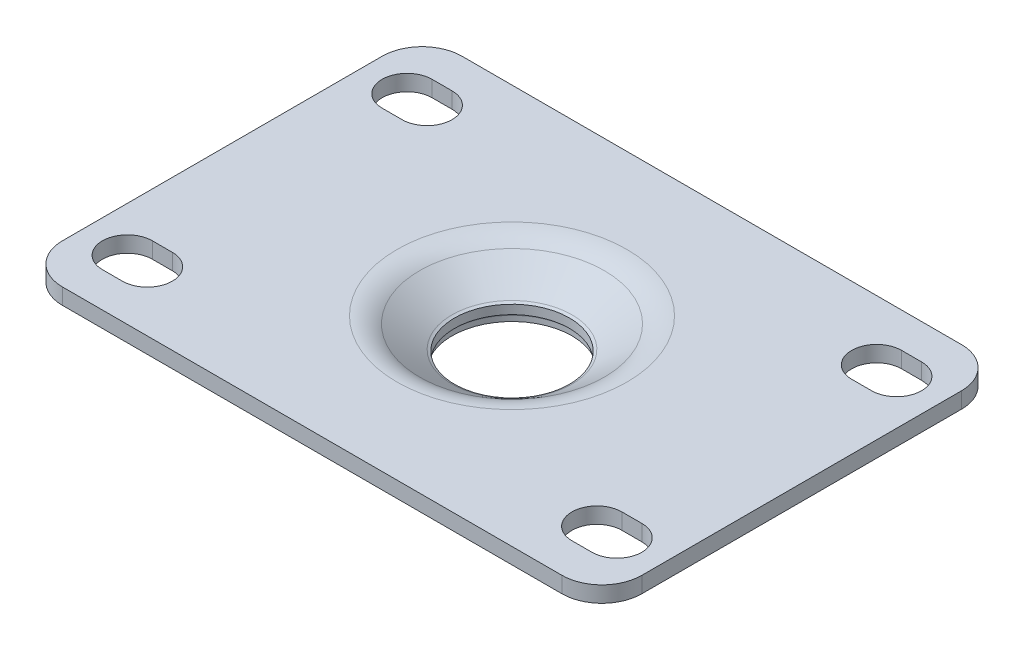
from build123d import *

# Parameters (mm, degrees)
SK_PLATE_OUTLINE_SLOTS_R = 19.05
EXT_PLATE_DEPTH          = 2.54


with BuildPart() as part:
    # Sk_pressed_centre → Rev_pressed_centre (revolve)
    with BuildSketch(Plane.XY, mode=Mode.PRIVATE) as rev_pressed_centre_sk:
        with BuildLine():
            Line((19.304, 69.85), (18.2626, 69.85))
            ThreePointArc((18.2626, 69.85), (16.381490046, 69.564975304), (14.669516, 68.73494))
            Line((14.669516, 68.73494), (9.54024, 65.2145))
            ThreePointArc((9.54024, 65.2145), (9.341458064, 65.091180356), (9.1313, 64.98844))
            Line((9.1313, 64.98844), (9.1313, 63.5508))
            Line((9.1313, 63.5508), (9.1567, 63.5508))
            ThreePointArc((9.1567, 63.5508), (9.426107684, 63.439207684), (9.5377, 63.1698))
            Line((9.5377, 63.1698), (9.5377, 62.31382))
            ThreePointArc((9.5377, 62.31382), (9.947965238, 62.460661275), (10.32764, 62.6745))
            Line((10.32764, 62.6745), (15.45717, 66.19494))
            ThreePointArc((15.45717, 66.19494), (17.169221611, 67.02429691), (19.05, 67.31))
            Line((19.05, 67.31), (19.304, 67.31))
            Line((19.304, 67.31), (19.304, 69.85))
        make_face()
    revolve(rev_pressed_centre_sk.sketch.rotate(Axis((0, -25.4, 0), (0, 1, 0)), 90), axis=Axis((0, -25.4, 0), (0, 1, 0)))

    # Sk_plate_outline_slots → Ext_plate (add)
    with BuildSketch(Plane(origin=(0, 67.31, 0), x_dir=(1, 0, 0), z_dir=(0, 1, 0))):
        with BuildLine():
            Line((-39.6875, 31.75), (39.6875, 31.75))
            ThreePointArc((39.6875, 31.75), (44.177628061, 29.890128061), (46.0375, 25.4))
            Line((46.0375, 25.4), (46.0375, -25.4))
            ThreePointArc((46.0375, -25.4), (44.177628061, -29.890128061), (39.6875, -31.75))
            Line((39.6875, -31.75), (-39.6875, -31.75))
            ThreePointArc((-39.6875, -31.75), (-44.177628061, -29.890128061), (-46.0375, -25.4))
            Line((-46.0375, -25.4), (-46.0375, 25.4))
            ThreePointArc((-46.0375, 25.4), (-44.177628061, 29.890128061), (-39.6875, 31.75))
        make_face()
        Circle(SK_PLATE_OUTLINE_SLOTS_R, mode=Mode.SUBTRACT)
        with BuildLine():
            Line((-38.89375, 26.19375), (-35.71875, 26.19375))
            ThreePointArc((-35.71875, 26.19375), (-31.75, 22.225), (-35.71875, 18.25625))
            Line((-35.71875, 18.25625), (-38.89375, 18.25625))
            ThreePointArc((-38.89375, 18.25625), (-42.8625, 22.225), (-38.89375, 26.19375))
        make_face(mode=Mode.SUBTRACT)
        with BuildLine():
            Line((-38.89375, -18.25625), (-35.71875, -18.25625))
            ThreePointArc((-35.71875, -18.25625), (-31.75, -22.225), (-35.71875, -26.19375))
            Line((-35.71875, -26.19375), (-38.89375, -26.19375))
            ThreePointArc((-38.89375, -26.19375), (-42.8625, -22.225), (-38.89375, -18.25625))
        make_face(mode=Mode.SUBTRACT)
        with BuildLine():
            Line((35.71875, 26.19375), (38.89375, 26.19375))
            ThreePointArc((38.89375, 26.19375), (42.8625, 22.225), (38.89375, 18.25625))
            Line((38.89375, 18.25625), (35.71875, 18.25625))
            ThreePointArc((35.71875, 18.25625), (31.75, 22.225), (35.71875, 26.19375))
        make_face(mode=Mode.SUBTRACT)
        with BuildLine():
            Line((35.71875, -18.25625), (38.89375, -18.25625))
            ThreePointArc((38.89375, -18.25625), (42.8625, -22.225), (38.89375, -26.19375))
            Line((38.89375, -26.19375), (35.71875, -26.19375))
            ThreePointArc((35.71875, -26.19375), (31.75, -22.225), (35.71875, -18.25625))
        make_face(mode=Mode.SUBTRACT)
    extrude(amount=EXT_PLATE_DEPTH)


solid = part.part
